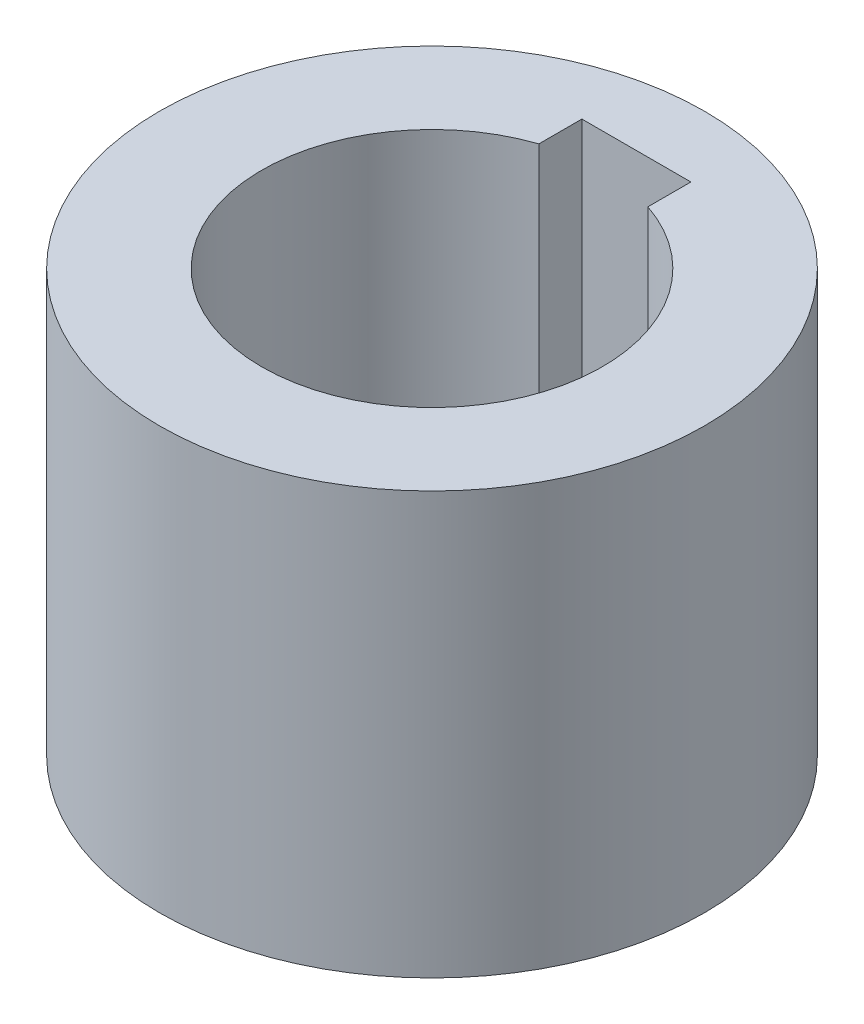
from build123d import *

# Parameters (mm, degrees)
SKETCH1_R               = 40
SKETCH1_R_2             = 25
BOSS_EXTRUDE1_DEPTH     = 61.9
CUT_EXTRUDE1_DEPTH      = 84.854695754
CUT_EXTRUDE1_DEPTH_BACK = 84.854695754
SKETCH2_W               = 16
SKETCH2_H               = 10


with BuildPart() as part:
    # Sketch1 → Boss-Extrude1 (new body)
    with BuildSketch(Plane(origin=(0, 0, 0), x_dir=(1, 0, 0), z_dir=(0, 1, 0))):
        with Locations(Location((0, 0, 0), (0, 0, 270))):
            Circle(SKETCH1_R)
        with Locations(Location((0, 0, 0), (0, 0, 270))):
            Circle(SKETCH1_R_2, mode=Mode.SUBTRACT)
    extrude(amount=BOSS_EXTRUDE1_DEPTH)

    # Sketch2 → Cut-Extrude1 (cut, two sides: drawn at the far end of the back side and taken through both)
    with BuildSketch(Plane(origin=(0, 61.9, 0), x_dir=(1, 0, 0), z_dir=(0, 1, 0)).offset(-CUT_EXTRUDE1_DEPTH_BACK)):
        with Locations((0, 25)):
            Rectangle(SKETCH2_W, SKETCH2_H)
    extrude(amount=CUT_EXTRUDE1_DEPTH + CUT_EXTRUDE1_DEPTH_BACK, mode=Mode.SUBTRACT)


solid = part.part
